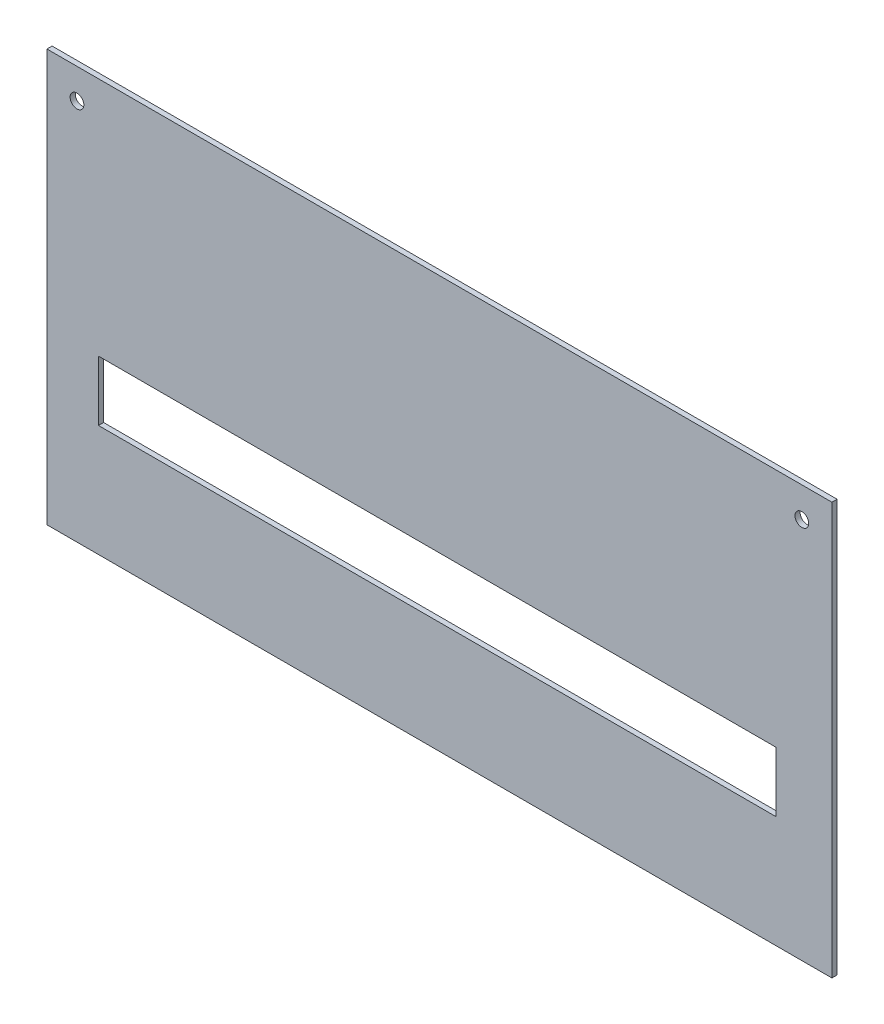
from build123d import *

# Parameters (mm, degrees)
SKETCH1_W           = 457.2
SKETCH1_H           = 240
BOSS_EXTRUDE1_DEPTH = 3
SKETCH2_R           = 4
CUT_EXTRUDE1_DEPTH  = 259.199457784
SKETCH3_W           = 394.7
SKETCH3_H           = 35
CUT_EXTRUDE2_DEPTH  = 259.199457784


with BuildPart() as part:
    # Sketch1 → Boss-Extrude1 (new body)
    with BuildSketch(Plane.XY):
        Rectangle(SKETCH1_W, SKETCH1_H)
    extrude(amount=BOSS_EXTRUDE1_DEPTH)

    # Sketch2 → Cut-Extrude1 (cut, through all)
    with BuildSketch(Plane.XY.offset(3)):
        with Locations((-211.1, 102.5)):
            Circle(SKETCH2_R)
        with Locations((211.1, 102.5)):
            Circle(SKETCH2_R)
    extrude(amount=-CUT_EXTRUDE1_DEPTH, mode=Mode.SUBTRACT)

    # Sketch3 → Cut-Extrude2 (cut, through all)
    with BuildSketch(Plane.XY.offset(3)):
        with Locations((-1.25, -37.4)):
            Rectangle(SKETCH3_W, SKETCH3_H)
    extrude(amount=-CUT_EXTRUDE2_DEPTH, mode=Mode.SUBTRACT)


solid = part.part
